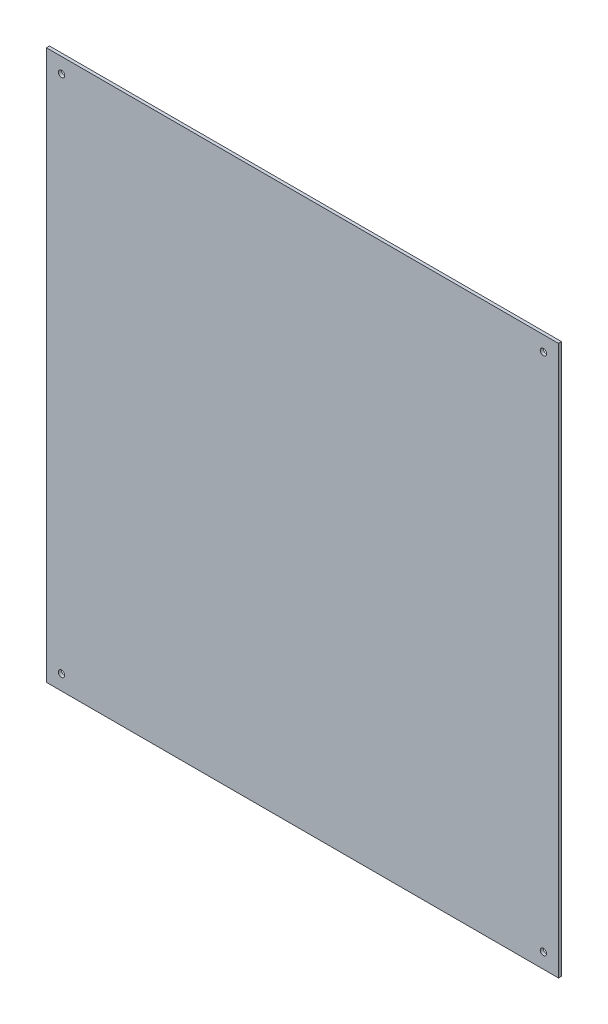
from build123d import *

# Parameters (mm, degrees)
SKETCH1_W           = 340
SKETCH1_H           = 365
SKETCH1_R           = 2.1
BOSS_EXTRUDE1_DEPTH = 2.032


with BuildPart() as part:
    # Sketch1 → Boss-Extrude1 (new body)
    with BuildSketch(Plane.XY):
        Rectangle(SKETCH1_W, SKETCH1_H)
        with Locations((-160, -172.5)):
            Circle(SKETCH1_R, mode=Mode.SUBTRACT)
        with Locations((160, -172.5)):
            Circle(SKETCH1_R, mode=Mode.SUBTRACT)
        with Locations((160, 172.5)):
            Circle(SKETCH1_R, mode=Mode.SUBTRACT)
        with Locations((-160, 172.5)):
            Circle(SKETCH1_R, mode=Mode.SUBTRACT)
    extrude(amount=BOSS_EXTRUDE1_DEPTH)


solid = part.part
